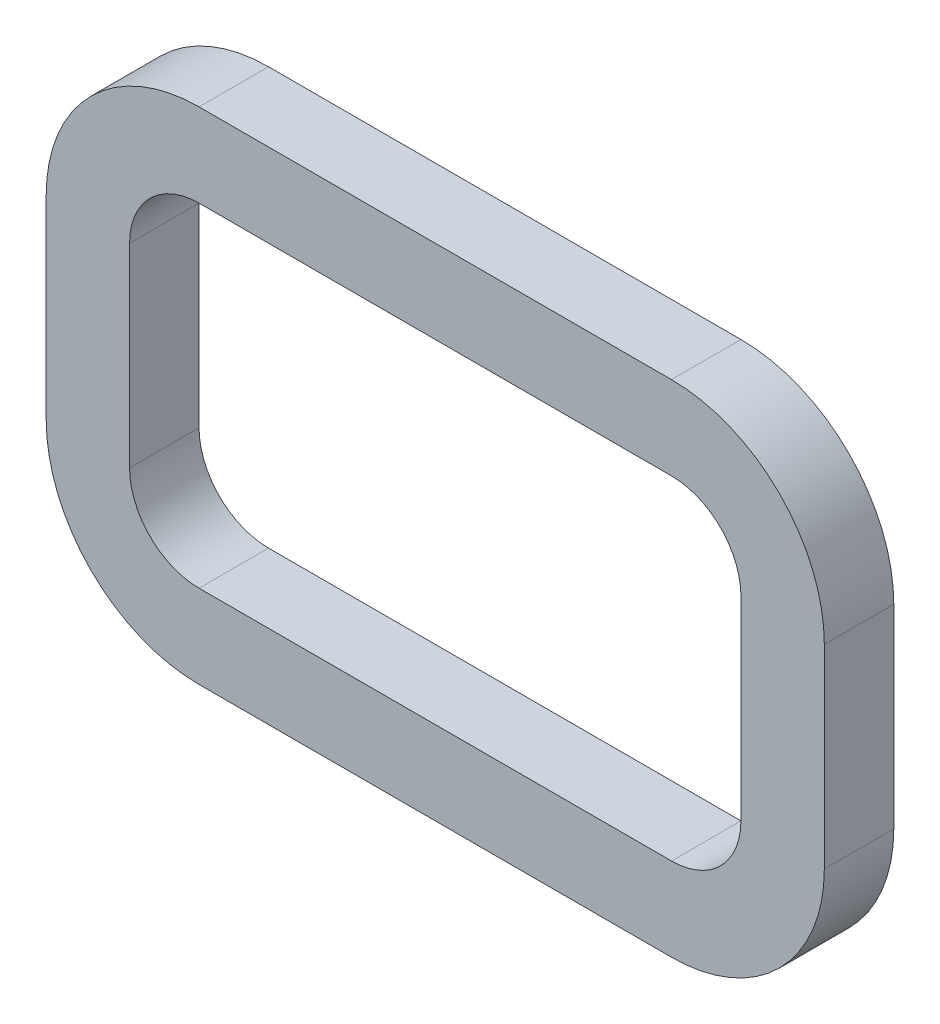
from build123d import *

# Parameters (mm, degrees)
EXTRUDE_THIN1_DEPTH = 50


with BuildPart() as part:
    # Sketch1 → Extrude-Thin1 (new body)
    with BuildSketch(Plane.XY):
        with BuildLine():
            Line((-170, 180), (170, 180))
            ThreePointArc((170, 180), (247.781745931, 147.781745931), (280, 70))
            Line((280, 70), (280, -70))
            ThreePointArc((280, -70), (247.781745931, -147.781745931), (170, -180))
            Line((170, -180), (-170, -180))
            ThreePointArc((-170, -180), (-247.781745931, -147.781745931), (-280, -70))
            Line((-280, -70), (-280, 70))
            ThreePointArc((-280, 70), (-247.781745931, 147.781745931), (-170, 180))
        make_face()
        with BuildLine():
            Line((-170, 120), (170, 120))
            ThreePointArc((170, 120), (205.355339059, 105.355339059), (220, 70))
            Line((220, 70), (220, -70))
            ThreePointArc((220, -70), (205.355339059, -105.355339059), (170, -120))
            Line((170, -120), (-170, -120))
            ThreePointArc((-170, -120), (-205.355339059, -105.355339059), (-220, -70))
            Line((-220, -70), (-220, 70))
            ThreePointArc((-220, 70), (-205.355339059, 105.355339059), (-170, 120))
        make_face(mode=Mode.SUBTRACT)
    extrude(amount=EXTRUDE_THIN1_DEPTH)


solid = part.part
